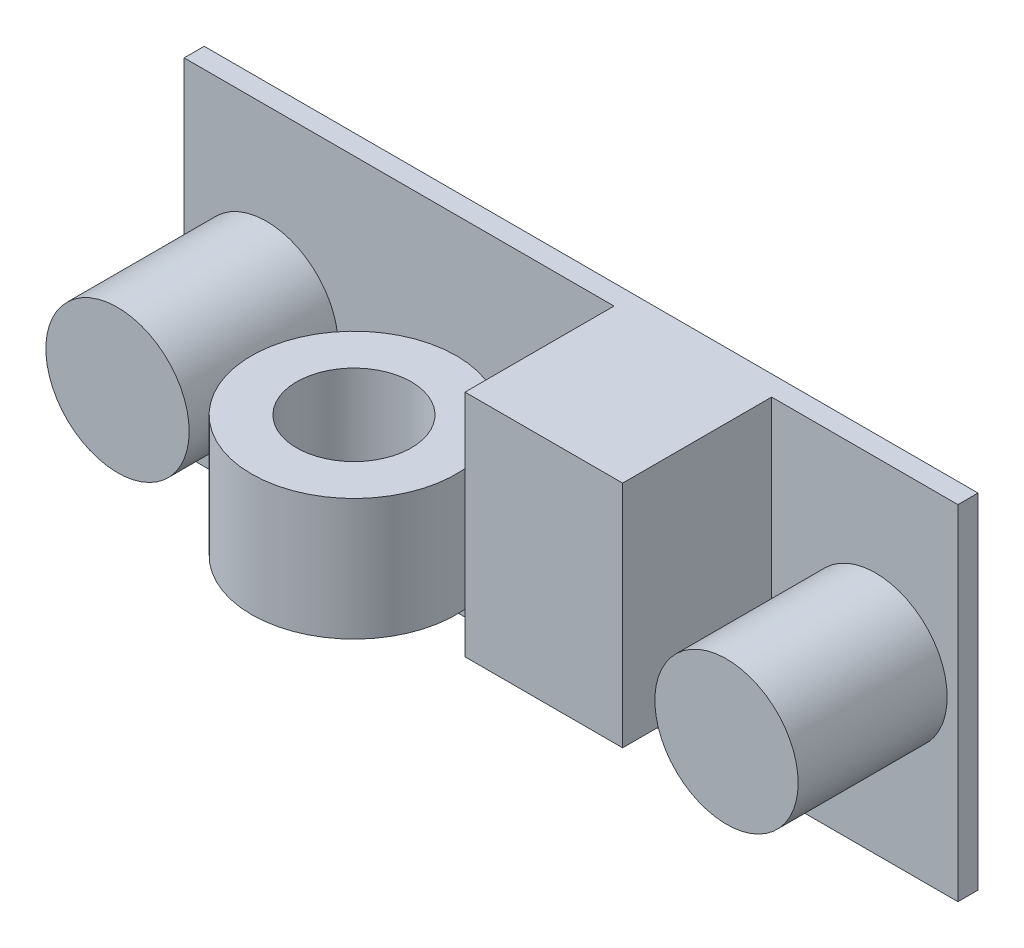
from build123d import *

# Parameters (mm, degrees)
ESBO_O1_W                     = 54
ESBO_O1_H                     = 24
RESSALTO_EXTRUS_O1_DEPTH      = 1.4
ESBO_O2_R                     = 5
ESBO_O2_W                     = 11
ESBO_O2_H                     = 16
RESSALTO_EXTRUS_O2_DEPTH      = 10.4
RESSALTO_EXTRUS_O3_DEPTH      = 3.5
RESSALTO_EXTRUS_O3_DEPTH_BACK = 5
ESBO_O4_R                     = 7.15
ESBO_O4_R_2                   = 4


with BuildPart() as part:
    # Esboço1 → Ressalto-extrusão1 (new body)
    with BuildSketch(Plane.XY):
        Rectangle(ESBO_O1_W, ESBO_O1_H)
    extrude(amount=RESSALTO_EXTRUS_O1_DEPTH)

    # Esboço2 → Ressalto-extrusão2 (add)
    with BuildSketch(Plane.XY.offset(1.4)):
        with Locations((21.25, 0)):
            Circle(ESBO_O2_R)
        with Locations((-21.25, 0)):
            Circle(ESBO_O2_R)
        with Locations((8.5, 4)):
            Rectangle(ESBO_O2_W, ESBO_O2_H)
    extrude(amount=RESSALTO_EXTRUS_O2_DEPTH)


with BuildPart() as body_2:
    # Esboço4 → Ressalto-extrusão3 (new, two sides: drawn at the far end of the back side and taken through both)
    with BuildSketch(Plane(origin=(0, 0, 0), x_dir=(1, 0, 0), z_dir=(0, 1, 0)).offset(-RESSALTO_EXTRUS_O3_DEPTH_BACK)):
        with Locations(Location((-8, -8.55, 0), (0, 0, 90))):
            Circle(ESBO_O4_R)
        with Locations(Location((-8, -8.55, 0), (0, 0, 90))):
            Circle(ESBO_O4_R_2, mode=Mode.SUBTRACT)
    extrude(amount=RESSALTO_EXTRUS_O3_DEPTH + RESSALTO_EXTRUS_O3_DEPTH_BACK)


solid = Compound([part.part, body_2.part])
